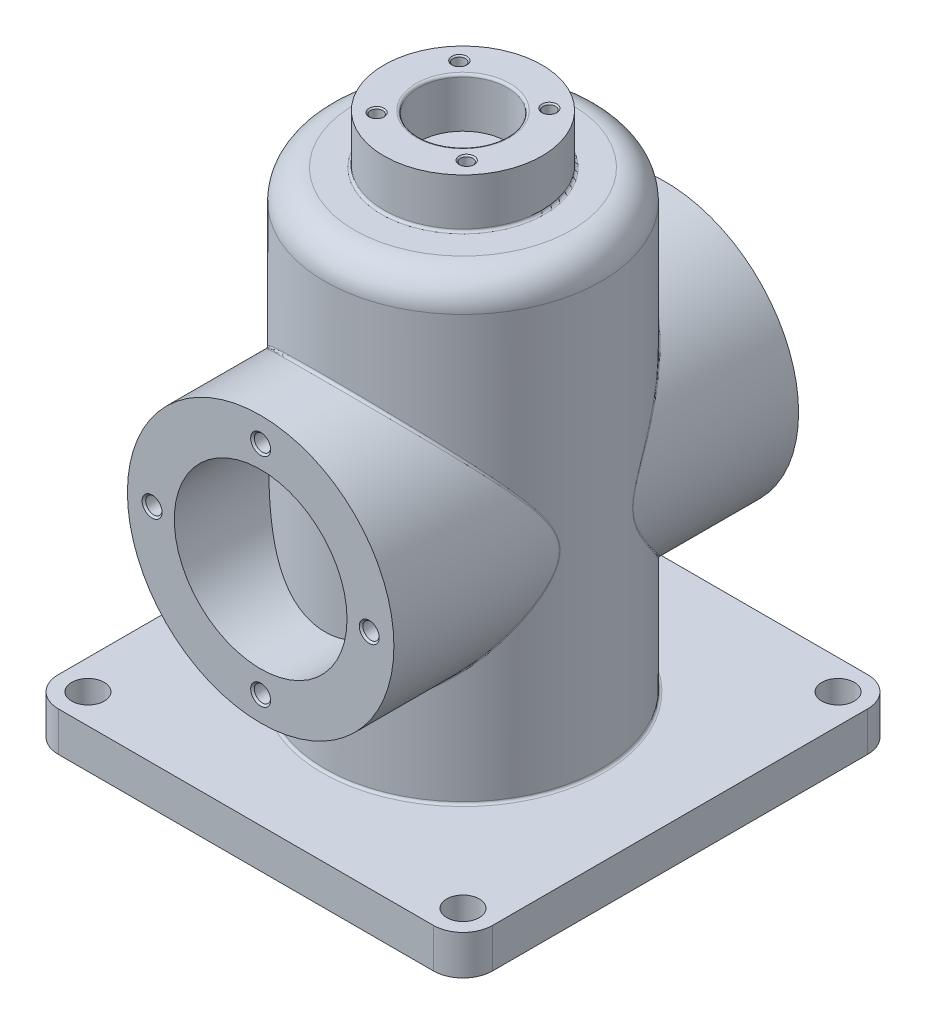
from build123d import *

# Parameters (mm, degrees)
SKETCH_2_W                  = 88
SKETCH_2_H                  = 88
EXTRUDE_1_DEPTH             = 8
SKETCH_5_W                  = 28
SKETCH_5_H                  = 92
SKETCH_6_R                  = 23
CUT_EXTRUDE_1_DEPTH         = 87
EXTRUDE_2_REACH             = 140.423
EXTRUDE_2_END_RADIUS        = 28
SKETCH_8_R                  = 27
SKETCH_8_R_2                = 17.5
EXTRUDE_3_REACH             = 128.38
SKETCH_9_R                  = 16
SKETCH_9_R_2                = 9
FILLET_1_R                  = 6
PATTERN_CIRCULAR_1_COUNT    = 4
PATTERN_CIRCULAR_2_COUNT    = 4
FILLET_2_R                  = 6
SKETCH_31_R                 = 3.3
CUT_EXTRUDE_2_DEPTH         = 120.48221625
PATTERN_LINEAR_1_COUNT      = 2
PATTERN_LINEAR_1_PITCH      = 76
PATTERN_LINEAR_1_COUNT_DIR2 = 2
PATTERN_LINEAR_1_PITCH_DIR2 = 76
FILLET_3_R                  = 0.5


with BuildPart() as part:
    # 스케치2 → 보스-돌출1 (new body)
    with BuildSketch(Plane(origin=(0, 0, 0), x_dir=(1, 0, 0), z_dir=(0, 1, 0))):
        Rectangle(SKETCH_2_W, SKETCH_2_H)
    extrude(amount=EXTRUDE_1_DEPTH)

    # 스케치5 → 회전1 (revolve)
    with BuildSketch(Plane.XY, mode=Mode.PRIVATE) as revolve_1_sk:
        with Locations((-14, 54)):
            Rectangle(SKETCH_5_W, SKETCH_5_H)
    revolve(revolve_1_sk.sketch.rotate(Axis((0, -14.683741451, 0), (0, 1, 0)), 270), axis=Axis((0, -14.683741451, 0), (0, 1, 0)))

    # 스케치6 → 컷-돌출1 (cut)
    with BuildSketch(Plane(origin=(0, 8, 0), x_dir=(1, 0, 0), z_dir=(0, 1, 0))):
        with Locations(Location((0, 0, 0), (0, 0, 270))):
            Circle(SKETCH_6_R)
    extrude(amount=CUT_EXTRUDE_1_DEPTH, mode=Mode.SUBTRACT)

    # 보스-돌출2: up to this cylinder (the profile starts outside it)
    extrude_2_end = Plane(origin=(0, 50, 0), z_dir=(0, -1, 0)) * Cylinder(EXTRUDE_2_END_RADIUS, 337.846, mode=Mode.PRIVATE)
    # 스케치8 → 보스-돌출2 (add, up to the surface)
    with BuildSketch(Plane.XY.offset(41), mode=Mode.PRIVATE) as extrude_2_sk1:
        with Locations((0, 50)):
            Circle(SKETCH_8_R)
        with Locations((0, 50)):
            Circle(SKETCH_8_R_2, mode=Mode.SUBTRACT)
    extrude_2_tool1 = extrude(extrude_2_sk1.sketch, amount=-EXTRUDE_2_REACH, mode=Mode.PRIVATE) - extrude_2_end
    extrude_2 = extrude_2_tool1.solids().sort_by_distance((-26.236325, 50, 41))[0]
    add(extrude_2)

    # 대칭 복사1: 보스-돌출2 across plane
    add(extrude_2.mirror(Plane.XY))

    # 스케치9 → 보스-돌출3 (add, up to next)
    with BuildSketch(Plane(origin=(0, 110, 0), x_dir=(1, 0, 0), z_dir=(0, 1, 0)), mode=Mode.PRIVATE) as extrude_3_sk1:
        with Locations(Location((0, 0, 0), (0, 0, 270))):
            Circle(SKETCH_9_R)
        with Locations(Location((0, 0, 0), (0, 0, 270))):
            Circle(SKETCH_9_R_2, mode=Mode.SUBTRACT)
    extrude_3_tool1 = extrude(extrude_3_sk1.sketch, amount=-EXTRUDE_3_REACH, mode=Mode.PRIVATE) - part.part
    add(extrude_3_tool1.solids().sort_by_distance((0, 110, -15.547452))[0])

    # 필렛1
    fillet_1_edges = [part.edges().sort_by_distance(p)[0] for p in [
        (0, 100, 28),
    ]]
    fillet(fillet_1_edges, radius=FILLET_1_R)

    # 스케치16 → M3 나사 구멍2 (revolve, cut)
    with BuildSketch(Plane(origin=(-9.121605162, 110, -8.37753193), x_dir=(0, 0, 1), z_dir=(1, 0, 0))):
        Polygon((0, 0), (0, 9.251075774), (1.25, 8.5), (1.25, 0.265564413), (1.525, 0), align=None)
    hole_wizard_m3_2 = revolve(axis=Axis((-9.121605162, 116.35, -8.37753193), (0, -1, 0)), mode=Mode.SUBTRACT)

    # 원형 패턴1: M3 나사 구멍2 ×4 about axis
    pattern_circular_1_axis = Axis((0, 0, 0), (0, 1, 0))
    for i in range(1, PATTERN_CIRCULAR_1_COUNT):
        add(hole_wizard_m3_2.rotate(pattern_circular_1_axis, i * 360 / PATTERN_CIRCULAR_1_COUNT), mode=Mode.SUBTRACT)

    # 스케치29 → M4 나사 구멍3 (revolve, cut)
    with BuildSketch(Plane(origin=(0, 72, 41), x_dir=(0, -1, 0), z_dir=(1, 0, 0))):
        Polygon((0, 0), (0, 12.491420021), (1.65, 11.5), (1.65, 0.362133291), (2.025, 0), align=None)
    hole_wizard_m4_3 = revolve(axis=Axis((0, 72, 47.35), (0, 0, -1)), mode=Mode.SUBTRACT)

    # 원형 패턴2: M4 나사 구멍3 ×4 about axis
    pattern_circular_2_axis = Axis((0, 50, 0), (0, 0, 1))
    for i in range(1, PATTERN_CIRCULAR_2_COUNT):
        add(hole_wizard_m4_3.rotate(pattern_circular_2_axis, i * 360 / PATTERN_CIRCULAR_2_COUNT), mode=Mode.SUBTRACT)

    # 대칭 복사2: M4 나사 구멍3 across plane
    add(hole_wizard_m4_3.mirror(Plane.XY), mode=Mode.SUBTRACT)

    # 대칭 복사2 copy 1 sketch → 대칭 복사2 copy 1 (revolve, cut)
    with BuildSketch(Plane(origin=(-22, 50, -41), x_dir=(1, 0, 0), z_dir=(0, 1, 0))):
        Polygon((0, 0), (0, -12.491420021), (1.65, -11.5), (1.65, -0.362133291), (2.025, 0), align=None)
    revolve(axis=Axis((-22, 50, -47.35), (0, 0, -1)), mode=Mode.SUBTRACT)

    # 대칭 복사2 copy 2 sketch → 대칭 복사2 copy 2 (revolve, cut)
    with BuildSketch(Plane(origin=(0, 28, -41), x_dir=(0, 1, 0), z_dir=(-1, 0, 0))):
        Polygon((0, 0), (0, -12.491420021), (1.65, -11.5), (1.65, -0.362133291), (2.025, 0), align=None)
    revolve(axis=Axis((0, 28, -47.35), (0, 0, -1)), mode=Mode.SUBTRACT)

    # 대칭 복사2 copy 3 sketch → 대칭 복사2 copy 3 (revolve, cut)
    with BuildSketch(Plane(origin=(22, 50, -41), x_dir=(-1, 0, 0), z_dir=(0, -1, 0))):
        Polygon((0, 0), (0, -12.491420021), (1.65, -11.5), (1.65, -0.362133291), (2.025, 0), align=None)
    revolve(axis=Axis((22, 50, -47.35), (0, 0, -1)), mode=Mode.SUBTRACT)

    # 필렛2
    fillet_2_edges = [part.edges().sort_by_distance(p)[0] for p in [
        (44, 4, 44),
        (-44, 4, 44),
        (-44, 4, -44),
        (44, 4, -44),
    ]]
    fillet(fillet_2_edges, radius=FILLET_2_R)

    # 스케치31 → 컷-돌출2 (cut, through all)
    with BuildSketch(Plane(origin=(0, 8, 0), x_dir=(1, 0, 0), z_dir=(0, 1, 0))):
        with Locations(Location((-38, 38, 0), (0, 0, 270))):
            Circle(SKETCH_31_R)
    cut_extrude_2 = extrude(amount=-CUT_EXTRUDE_2_DEPTH, mode=Mode.SUBTRACT)

    # 선형 패턴1: Cut-Extrude 2 2 × 2
    with Locations(*[(j * PATTERN_LINEAR_1_PITCH_DIR2, 0, i * PATTERN_LINEAR_1_PITCH) for i in range(PATTERN_LINEAR_1_COUNT) for j in range(PATTERN_LINEAR_1_COUNT_DIR2) if (i, j) != (0, 0)]):
        add(cut_extrude_2, mode=Mode.SUBTRACT)

    # 필렛3
    fillet_3_edges = [part.edges().sort_by_distance(p)[0] for p in [
        (0, 8, 28),
        (-27, 50, 7.416198487),
        (-27, 50, -7.416198487),
        (0, 100, -16),
        (0, 110, -9),
    ]]
    fillet(fillet_3_edges, radius=FILLET_3_R)


solid = part.part
